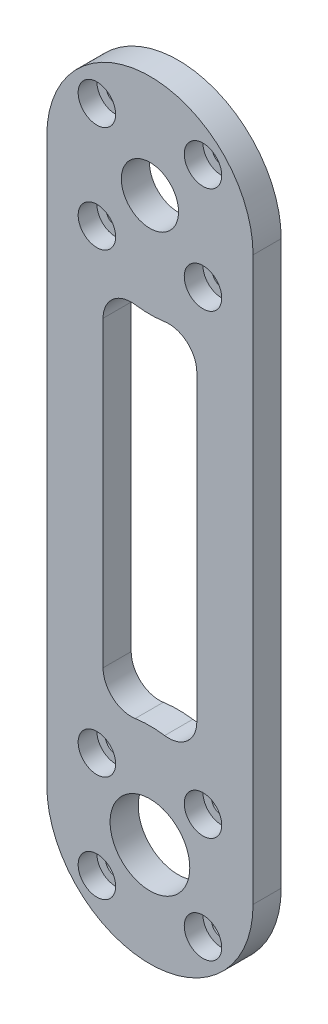
from build123d import *

# Parameters (mm, degrees)
BOSS_EXTRUDE1_DEPTH = 3
SKETCH3_R           = 4.25
SKETCH3_R_2         = 1.1
CUT_EXTRUDE3_DEPTH  = 3
SKETCH3_6_R         = 2
CUT_EXTRUDE4_DEPTH  = 2
CIRPATTERN3_COUNT   = 4
SKETCH2_R           = 3.05
SKETCH2_R_2         = 1
CUT_EXTRUDE5_DEPTH  = 3
SKETCH2_5_R         = 2
CUT_EXTRUDE6_DEPTH  = 2
CIRPATTERN4_COUNT   = 4
FILLET1_R           = 3


with BuildPart() as part:
    # Sketch1 → Boss-Extrude1 (new body)
    with BuildSketch(Plane.XY):
        with BuildLine():
            ThreePointArc((11, 30), (0, 41), (-11, 30))
            Line((-11, 30), (-11, -30))
            ThreePointArc((-11, -30), (0, -41), (11, -30))
            Line((11, -30), (11, 30))
        make_face()
        with BuildLine():
            ThreePointArc((0, 19), (2.571230378, 19.304731217), (5, 20.202041029))
            Line((5, 20.202041029), (5, -20.202041029))
            ThreePointArc((5, -20.202041029), (2.571230378, -19.304731217), (0, -19))
            ThreePointArc((0, -19), (-2.571230378, -19.304731217), (-5, -20.202041029))
            Line((-5, -20.202041029), (-5, 20.202041029))
            ThreePointArc((-5, 20.202041029), (-2.571230378, 19.304731217), (0, 19))
        make_face(mode=Mode.SUBTRACT)
    extrude(amount=BOSS_EXTRUDE1_DEPTH)

    # Sketch3 → Cut-Extrude3 (cut)
    with BuildSketch(Plane.XY.offset(3)):
        with Locations((0, -30)):
            Circle(SKETCH3_R)
        with Locations((5.656854249, -24.343145751)):
            Circle(SKETCH3_R_2)
    cut_extrude3 = extrude(amount=-CUT_EXTRUDE3_DEPTH, mode=Mode.SUBTRACT)

    # Sketch3<6> → Cut-Extrude4 (cut)
    with BuildSketch(Plane.XY.offset(3)):
        with Locations((5.656854249, -24.343145751)):
            Circle(SKETCH3_6_R)
    cut_extrude4 = extrude(amount=-CUT_EXTRUDE4_DEPTH, mode=Mode.SUBTRACT)

    # CirPattern3: Cut-Extrude3, Cut-Extrude4 ×4 about axis
    cirpattern3_axis = Axis((0, -30, 0), (0, 0, 1))
    add([cut_extrude3.rotate(cirpattern3_axis, i * 360 / CIRPATTERN3_COUNT) for i in range(1, CIRPATTERN3_COUNT)], mode=Mode.SUBTRACT)
    add([cut_extrude4.rotate(cirpattern3_axis, i * 360 / CIRPATTERN3_COUNT) for i in range(1, CIRPATTERN3_COUNT)], mode=Mode.SUBTRACT)

    # Sketch2 → Cut-Extrude5 (cut)
    with BuildSketch(Plane.XY.offset(3)):
        with Locations((0, 30)):
            Circle(SKETCH2_R)
        with Locations((5.656854249, 35.656854249)):
            Circle(SKETCH2_R_2)
    cut_extrude5 = extrude(amount=-CUT_EXTRUDE5_DEPTH, mode=Mode.SUBTRACT)

    # Sketch2<5> → Cut-Extrude6 (cut)
    with BuildSketch(Plane.XY.offset(3)):
        with Locations((5.656854249, 35.656854249)):
            Circle(SKETCH2_5_R)
    cut_extrude6 = extrude(amount=-CUT_EXTRUDE6_DEPTH, mode=Mode.SUBTRACT)

    # CirPattern4: Cut-Extrude5, Cut-Extrude6 ×4 about axis
    cirpattern4_axis = Axis((0, 30, 0), (0, 0, 1))
    add([cut_extrude5.rotate(cirpattern4_axis, i * 360 / CIRPATTERN4_COUNT) for i in range(1, CIRPATTERN4_COUNT)], mode=Mode.SUBTRACT)
    add([cut_extrude6.rotate(cirpattern4_axis, i * 360 / CIRPATTERN4_COUNT) for i in range(1, CIRPATTERN4_COUNT)], mode=Mode.SUBTRACT)

    # Fillet1
    fillet1_edges = [part.edges().sort_by_distance(p)[0] for p in [
        (5, 20.202041029, 1.5),
        (-5, 20.202041029, 1.5),
        (-5, -20.202041029, 1.5),
        (5, -20.202041029, 1.5),
    ]]
    fillet(fillet1_edges, radius=FILLET1_R)


solid = part.part
